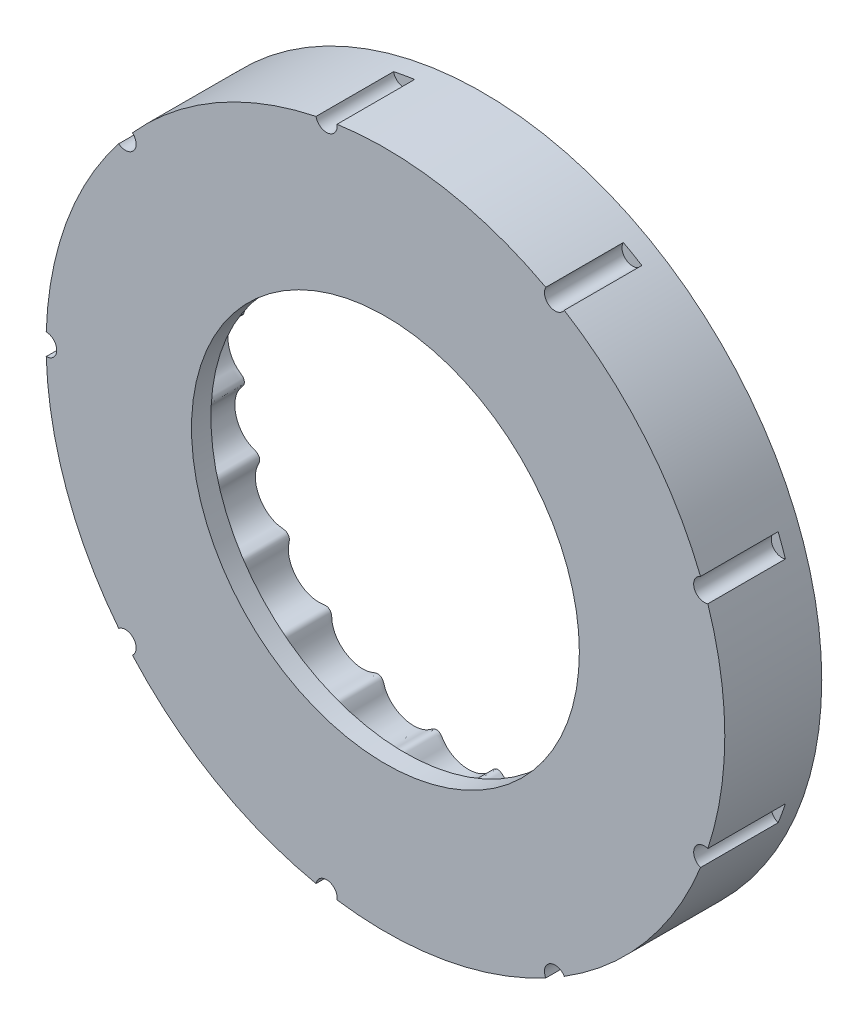
from build123d import *

# Parameters (mm, degrees)
ESQUISSE1_R             = 35
BOSS_EXTRU_1_DEPTH      = 8
ESQUISSE3_R             = 35
ESQUISSE3_R_2           = 20
BOSS_EXTRU_2_DEPTH      = 2
ESQUISSE4_R             = 1.1
ENL_V_MAT_EXTRU_2_DEPTH = 8


with BuildPart() as part:
    # Esquisse1 → Boss.-Extru.1 (new body)
    with BuildSketch(Plane.XY):
        Circle(ESQUISSE1_R)
        with BuildLine():
            add(Edge.make_bspline(
                [(24.75, 0), (24.75, -0.01190895), (24.750668659, -0.029768799), (24.75289752, -0.060006713), (24.758884934, -0.104774168), (24.767485304, -0.1467503), (24.785152354, -0.206071411), (24.818482478, -0.284185867), (24.880818803, -0.385919884), (24.984658612, -0.50047292), (25.114781066, -0.616600782), (25.255435339, -0.752464933), (25.419807145, -0.93333087), (25.594989864, -1.169106201), (25.768920192, -1.472936072), (25.920736133, -1.849650866), (26.023477253, -2.249860974), (26.074696747, -2.666946621), (26.073312156, -3.086313852), (26.020370658, -3.501501101), (25.917002683, -3.906273732), (25.764403676, -4.294347485), (25.566224565, -4.654785317), (25.325903213, -4.981499954), (25.081588671, -5.233067427), (24.851914535, -5.418631885), (24.667098284, -5.540217829), (24.539548747, -5.613941762), (24.410179088, -5.684594723), (24.273991814, -5.758046627), (24.120002912, -5.867762768), (23.989867, -6.050335584), (23.936355638, -6.275127193), (23.969192195, -6.495758333), (24.065351302, -6.684284012), (24.178449314, -6.851934675), (24.280144364, -7.019011908), (24.393570042, -7.235347013), (24.503436737, -7.50770452), (24.595094748, -7.84543671), (24.647032867, -8.248159789), (24.645694803, -8.661209862), (24.57595365, -9.185528563), (24.417645445, -9.696077248), (24.174741138, -10.176578568), (23.852030812, -10.610062282), (23.558837347, -10.90980476), (23.24095056, -11.157802847), (22.946586259, -11.329086722), (22.692113519, -11.440823192), (22.472657763, -11.513539342), (22.29388462, -11.561503733), (22.101259895, -11.606028638), (21.902055354, -11.681610724), (21.728453668, -11.828148656), (21.620885016, -12.038837081), (21.601595838, -12.263660858), (21.650481834, -12.469316746), (21.718254479, -12.659791435), (21.774584138, -12.84705718), (21.829677768, -13.084963879), (21.867201208, -13.376160202), (21.870688906, -13.725995236), (21.819474916, -14.128698884), (21.71419458, -14.527993453), (21.514773646, -15.017801417), (21.233133123, -15.4720736), (20.877140734, -15.876030958), (20.455657215, -16.214386724), (20.096354081, -16.430676116), (19.726170583, -16.590569736), (19.398076252, -16.68206281), (19.123633935, -16.725922166), (18.892914818, -16.74091163), (18.707848134, -16.742350192), (18.510091067, -16.737829569), (18.298399992, -16.764443666), (18.095471353, -16.866909122), (17.942147178, -17.047179332), (17.871387572, -17.261366287), (17.870202468, -17.472525416), (17.888313355, -17.673814374), (17.895669209, -17.869207586), (17.888886536, -18.113260777), (17.85168272, -18.404436203), (17.766823301, -18.743754438), (17.615819616, -19.120463832), (17.413434594, -19.48028858), (17.162321288, -19.816819375), (16.868500143, -20.122110223), (16.535786091, -20.390797243), (16.168397966, -20.617282366), (15.771042449, -20.795687849), (15.368766607, -20.914546396), (14.97017149, -20.975982916), (14.629556137, -20.981746846), (14.352921577, -20.954877105), (14.125857036, -20.911170138), (13.94640051, -20.866001244), (13.755772511, -20.812781493), (13.543469889, -20.788894817), (13.322238716, -20.84166807), (13.131407642, -20.981742865), (13.0130413, -21.173627181), (12.961818542, -21.378246364), (12.929064797, -21.57761534), (12.886990745, -21.768547341), (12.818791692, -22.002934942), (12.70930802, -22.275243379), (12.541628211, -22.582120244), (12.300626204, -22.908551746), (12.01422203, -23.205749325), (11.686582401, -23.4681837), (11.325453487, -23.689705246), (10.935854532, -23.866053147), (10.523258626, -23.992837457), (10.093696991, -24.06550579), (9.674368845, -24.079231972), (9.273085465, -24.038208914), (8.941983123, -23.957846351), (8.681067639, -23.861969077), (8.472360468, -23.762392874), (8.310008249, -23.673519219), (8.138322101, -23.574972467), (7.937182673, -23.501849574), (7.704899941, -23.502076627), (7.478095746, -23.600741865), (7.316947907, -23.77285878), (7.220831609, -23.97055906), (7.115634845, -24.203403783), (6.974300377, -24.460401189), (6.773045478, -24.737487424), (6.497851462, -25.02237666), (6.183428844, -25.270910892), (5.835740341, -25.479668636), (5.460328709, -25.645214949), (5.061542815, -25.765601822), (4.644666369, -25.83709061), (4.215744672, -25.855893135), (3.781608585, -25.818103671), (3.372294549, -25.725760832), (2.994169108, -25.584908149), (2.694109042, -25.423555897), (2.465647641, -25.264915254), (2.289085947, -25.115815571), (2.153739497, -24.989104422), (2.012318186, -24.851122457), (1.832423714, -24.733108156), (1.552983355, -24.66593755), (1.26214529, -24.754622086), (1.075414287, -24.957557798), (0.889090341, -25.194134228), (0.69672049, -25.401829912), (0.44758856, -25.61527269), (0.125683965, -25.821812182), (-0.224585626, -25.987068298), (-0.598975616, -26.109092558), (-0.990876156, -26.185347308), (-1.391941275, -26.2145582), (-1.796224618, -26.195837186), (-2.198144681, -26.128499562), (-2.591457519, -26.011923113), (-2.962803429, -25.848997421), (-3.306221845, -25.642423994), (-3.61537583, -25.39483403), (-3.850272783, -25.145621471), (-4.023133112, -24.908691884), (-4.156981332, -24.691054937), (-4.276293257, -24.506578487), (-4.456318725, -24.354528199), (-4.693068775, -24.282897531), (-4.923798246, -24.309710303), (-5.115035952, -24.406102337), (-5.273240645, -24.525178417), (-5.42301226, -24.633920894), (-5.617383402, -24.75923363), (-5.863981708, -24.887558689), (-6.182207181, -25.009385657), (-6.575059912, -25.101071531), (-6.9927825, -25.140689035), (-7.428136381, -25.123106217), (-7.851204623, -25.050059218), (-8.255644199, -24.926289526), (-8.635975215, -24.756290763), (-8.987390026, -24.544434268), (-9.305810055, -24.293211507), (-9.586131065, -24.006734367), (-9.822904508, -23.689158592), (-9.987239236, -23.388704672), (-10.094751199, -23.11580793), (-10.169610451, -22.871508954), (-10.24112571, -22.663502872), (-10.381175345, -22.473662137), (-10.594956363, -22.349311543), (-10.825624608, -22.322047042), (-11.033849204, -22.370890621), (-11.216381876, -22.447371753), (-11.388695767, -22.514940651), (-11.608352834, -22.58716666), (-11.87933894, -22.649041617), (-12.217942215, -22.68664221), (-12.621151131, -22.6763477), (-13.035301253, -22.609509201), (-13.452127793, -22.482943679), (-13.845292771, -22.304868342), (-14.20938889, -22.080540487), (-14.539531306, -21.814993299), (-14.831269767, -21.513076759), (-15.077661765, -21.181891436), (-15.275270226, -20.827454377), (-15.402577207, -20.501715906), (-15.476526159, -20.217667398), (-15.514326563, -19.976485954), (-15.531829272, -19.781749163), (-15.539202372, -19.579813227), (-15.565591069, -19.370421028), (-15.660806856, -19.1659885), (-15.83405536, -19.004717982), (-16.047591105, -18.926560558), (-16.261088064, -18.925182163), (-16.456798489, -18.954287053), (-16.640543184, -18.976331541), (-16.871307425, -18.990807395), (-17.149104778, -18.982241272), (-17.486194881, -18.933211709), (-17.873723074, -18.821638459), (-18.257615968, -18.652692803), (-18.629084532, -18.425342732), (-18.964764813, -18.15411038), (-19.260725449, -17.845401443), (-19.513475385, -17.50529118), (-19.719894943, -17.139574851), (-19.874988153, -16.756923442), (-19.976929286, -16.364037242), (-20.017953734, -16.016642642), (-20.017798024, -15.723070973), (-19.993447495, -15.480115157), (-19.96134753, -15.287225434), (-19.918054975, -15.089779832), (-19.89402871, -14.879875268), (-19.939362883, -14.658860507), (-20.070693635, -14.462043286), (-20.260249499, -14.336679591), (-20.467155514, -14.285214031), (-20.663881817, -14.2650629), (-20.847282484, -14.240161779), (-21.074211831, -14.195950386), (-21.340836688, -14.11751373), (-21.654611423, -13.985047804), (-22.001454707, -13.779432555), (-22.330360371, -13.519308084), (-22.705485211, -13.130240844), (-23.007369545, -12.684411231), (-23.229136266, -12.198075036), (-23.364819327, -11.686883469), (-23.418570267, -11.277399868), (-23.418213213, -10.871399708), (-23.370257339, -10.524800668), (-23.295965049, -10.240716159), (-23.211017087, -10.011726748), (-23.131365089, -9.833119484), (-23.040198426, -9.652618084), (-22.96715924, -9.454144986), (-22.960141523, -9.228680333), (-23.042373084, -9.007208297), (-23.198166311, -8.840665724), (-23.388940312, -8.741382585), (-23.57769294, -8.6722803), (-23.75308195, -8.599853942), (-23.966244513, -8.496298837), (-24.209343816, -8.347711506), (-24.48032477, -8.1355972), (-24.761295108, -7.846344695), (-25.008480075, -7.513349868), (-25.26655565, -7.04900195), (-25.442920247, -6.54763643), (-25.533949151, -6.025561479), (-25.536599067, -5.498854498), (-25.485486947, -5.088916426), (-25.382794666, -4.696000106), (-25.248906316, -4.372612425), (-25.105242941, -4.116427211), (-24.965170858, -3.916248887), (-24.843083512, -3.763442502), (-24.709834093, -3.611215538), (-24.591948067, -3.435387495), (-24.533798882, -3.220620895), (-24.560423715, -2.992589013), (-24.66665443, -2.797016304), (-24.822727104, -2.653701408), (-24.98966356, -2.53926073), (-25.146322188, -2.422077132), (-25.332496393, -2.263776399), (-25.502275925, -2.087254142), (-25.654526877, -1.895838833), (-25.79052351, -1.688263992), (-25.890012472, -1.511998867), (-25.978955887, -1.325507929), (-26.056614781, -1.131467198), (-26.121383307, -0.930707527), (-26.173241314, -0.729759288), (-26.207287779, -0.545661218), (-26.228372118, -0.39585777), (-26.240536879, -0.255725402), (-26.247025958, -0.16909655), (-26.249459241, -0.066739393), (-26.25, -0.022255367), (-26.25, 0)],
                knots=[0.07432085, 0.07432085, 0.07432085, 0.07432085, 0.07432085, 0.074838236, 0.075096929, 0.075355622, 0.075873009, 0.076390395, 0.077425167, 0.07845994, 0.080262761, 0.082065582, 0.083868403, 0.085671224, 0.089276866, 0.092882508, 0.096749545, 0.100616583, 0.104483621, 0.108350658, 0.112188336, 0.116026013, 0.11986369, 0.123701367, 0.12732655, 0.130951733, 0.132764324, 0.134576916, 0.135483211, 0.136389507, 0.138202099, 0.140295775, 0.142389451, 0.144458848, 0.146528245, 0.148330503, 0.150132762, 0.15193502, 0.153737278, 0.157341795, 0.160946311, 0.164812321, 0.16867833, 0.17254434, 0.180415799, 0.184421248, 0.188426697, 0.192432147, 0.195844027, 0.199255907, 0.200961848, 0.202667788, 0.204373728, 0.206079668, 0.208268892, 0.210458115, 0.21252702, 0.214595925, 0.216397713, 0.218199501, 0.220001289, 0.221803077, 0.225406654, 0.22901023, 0.232875219, 0.236740209, 0.240605199, 0.248476586, 0.252482983, 0.25648938, 0.260495777, 0.263907756, 0.267319735, 0.269025725, 0.270731714, 0.272437704, 0.274143693, 0.276335152, 0.278526612, 0.280594702, 0.282662792, 0.284464203, 0.286265613, 0.288067024, 0.289868435, 0.293471257, 0.297074079, 0.300938067, 0.304802055, 0.308666044, 0.312530032, 0.316537343, 0.320544653, 0.324551964, 0.328559274, 0.331971493, 0.335383713, 0.337089822, 0.338795932, 0.340502041, 0.342208151, 0.3444015, 0.346594848, 0.348661829, 0.35072881, 0.352529935, 0.354331061, 0.356132186, 0.357933311, 0.361535562, 0.365137813, 0.369000829, 0.372863844, 0.37672686, 0.380589876, 0.384598055, 0.388606234, 0.392614413, 0.396622592, 0.400035189, 0.403447785, 0.405154083, 0.406860381, 0.408566679, 0.410272977, 0.412467856, 0.414662735, 0.416905332, 0.41914793, 0.420947533, 0.422747136, 0.426346341, 0.429945547, 0.433544752, 0.437320979, 0.441097206, 0.444873433, 0.44864966, 0.452658654, 0.456667648, 0.460676642, 0.464685636, 0.468098738, 0.471511839, 0.473218389, 0.47492494, 0.476631491, 0.478338041, 0.480534086, 0.48273013, 0.487019518, 0.488748834, 0.49047815, 0.493936782, 0.497395414, 0.500854047, 0.504530334, 0.508206621, 0.511882908, 0.515559195, 0.519334982, 0.52311077, 0.526886557, 0.530662345, 0.534261527, 0.537860709, 0.541459892, 0.543259483, 0.545059074, 0.547300663, 0.549542252, 0.55173776, 0.553933267, 0.555639684, 0.5573461, 0.559052517, 0.560758933, 0.564171767, 0.5675846, 0.571593194, 0.575601788, 0.579610382, 0.583618976, 0.587395654, 0.591172332, 0.594949011, 0.598725689, 0.602324954, 0.605924219, 0.609523484, 0.611323117, 0.613122749, 0.615366313, 0.617609877, 0.619804036, 0.621998195, 0.623704391, 0.625410586, 0.627116782, 0.628822977, 0.632235368, 0.635647759, 0.63965551, 0.643663261, 0.647671012, 0.651678763, 0.655542261, 0.659405759, 0.663269257, 0.667132755, 0.670735268, 0.674337782, 0.676139039, 0.677940295, 0.679741552, 0.681542809, 0.683610379, 0.685677949, 0.687870397, 0.690062845, 0.691768886, 0.693474927, 0.695180968, 0.696887009, 0.700299091, 0.703711172, 0.707718031, 0.71172489, 0.715731748, 0.719738607, 0.723603093, 0.727467579, 0.731332066, 0.735196552, 0.738799727, 0.742402903, 0.744204491, 0.746006079, 0.747807667, 0.749609255, 0.751677791, 0.753746327, 0.755936711, 0.758127095, 0.75983305, 0.761539006, 0.763244962, 0.764950918, 0.76836283, 0.771774741, 0.775780668, 0.779786595, 0.783792522, 0.791663947, 0.795529445, 0.799394943, 0.803260441, 0.806864464, 0.810468487, 0.812270499, 0.81407251, 0.815874522, 0.817676533, 0.819745726, 0.821814919, 0.823998833, 0.826182748, 0.827931402, 0.829680057, 0.831428712, 0.833177366, 0.836674676, 0.840171985, 0.844093542, 0.8480151, 0.851936657, 0.859724738, 0.863591261, 0.867457784, 0.871324307, 0.874929364, 0.87853442, 0.880336948, 0.882139476, 0.883942004, 0.885744532, 0.887814048, 0.889883563, 0.891953048, 0.894022532, 0.895825669, 0.897628805, 0.899431941, 0.901235078, 0.90484135, 0.906644487, 0.908447623, 0.910381399, 0.912315175, 0.914248951, 0.916182727, 0.918116503, 0.920050278, 0.921017166, 0.921984054, 0.922950942, 0.92391783, 0.92391783, 0.92391783, 0.92391783, 0.92391783], degree=4))
            add(Edge.make_bspline(
                [(24.75, 0), (24.75, 0.01190895), (24.750668659, 0.029768799), (24.75289752, 0.060006713), (24.758884934, 0.104774168), (24.767485304, 0.1467503), (24.785152354, 0.206071411), (24.818482478, 0.284185867), (24.880818803, 0.385919884), (24.984658612, 0.50047292), (25.114781066, 0.616600782), (25.255435339, 0.752464933), (25.419807145, 0.93333087), (25.594989864, 1.169106201), (25.768920192, 1.472936072), (25.920736133, 1.849650866), (26.023477253, 2.249860974), (26.074696747, 2.666946621), (26.073312156, 3.086313852), (26.020370658, 3.501501101), (25.917002683, 3.906273732), (25.764403676, 4.294347485), (25.566224565, 4.654785317), (25.325903213, 4.981499954), (25.081588671, 5.233067427), (24.851914535, 5.418631885), (24.667098284, 5.540217829), (24.539548747, 5.613941762), (24.410179088, 5.684594723), (24.273991814, 5.758046627), (24.120002912, 5.867762768), (23.989867, 6.050335584), (23.936355638, 6.275127193), (23.969192195, 6.495758333), (24.065351302, 6.684284012), (24.178449314, 6.851934675), (24.280144364, 7.019011908), (24.393570042, 7.235347013), (24.503436737, 7.50770452), (24.595094748, 7.84543671), (24.647032867, 8.248159789), (24.645694803, 8.661209862), (24.57595365, 9.185528563), (24.417645445, 9.696077248), (24.174741138, 10.176578568), (23.852030812, 10.610062282), (23.558837347, 10.90980476), (23.24095056, 11.157802847), (22.946586259, 11.329086722), (22.692113519, 11.440823192), (22.472657763, 11.513539342), (22.29388462, 11.561503733), (22.101259895, 11.606028638), (21.902055354, 11.681610724), (21.728453668, 11.828148656), (21.620885016, 12.038837081), (21.601595838, 12.263660858), (21.650481834, 12.469316746), (21.718254479, 12.659791435), (21.774584138, 12.84705718), (21.829677768, 13.084963879), (21.867201208, 13.376160202), (21.870688906, 13.725995236), (21.819474916, 14.128698884), (21.71419458, 14.527993453), (21.514773646, 15.017801417), (21.233133123, 15.4720736), (20.877140734, 15.876030958), (20.455657215, 16.214386724), (20.096354081, 16.430676116), (19.726170583, 16.590569736), (19.398076252, 16.68206281), (19.123633935, 16.725922166), (18.892914818, 16.74091163), (18.707848134, 16.742350192), (18.510091067, 16.737829569), (18.298399992, 16.764443666), (18.095471353, 16.866909122), (17.942147178, 17.047179332), (17.871387572, 17.261366287), (17.870202468, 17.472525416), (17.888313355, 17.673814374), (17.895669209, 17.869207586), (17.888886536, 18.113260777), (17.85168272, 18.404436203), (17.766823301, 18.743754438), (17.615819616, 19.120463832), (17.413434594, 19.48028858), (17.162321288, 19.816819375), (16.868500143, 20.122110223), (16.535786091, 20.390797243), (16.168397966, 20.617282366), (15.771042449, 20.795687849), (15.368766607, 20.914546396), (14.97017149, 20.975982916), (14.629556137, 20.981746846), (14.352921577, 20.954877105), (14.125857036, 20.911170138), (13.94640051, 20.866001244), (13.755772511, 20.812781493), (13.543469889, 20.788894817), (13.322238716, 20.84166807), (13.131407642, 20.981742865), (13.0130413, 21.173627181), (12.961818542, 21.378246364), (12.929064797, 21.57761534), (12.886990745, 21.768547341), (12.818791692, 22.002934942), (12.70930802, 22.275243379), (12.541628211, 22.582120244), (12.300626204, 22.908551746), (12.01422203, 23.205749325), (11.686582401, 23.4681837), (11.325453487, 23.689705246), (10.935854532, 23.866053147), (10.523258626, 23.992837457), (10.093696991, 24.06550579), (9.674368845, 24.079231972), (9.273085465, 24.038208914), (8.941983123, 23.957846351), (8.681067639, 23.861969077), (8.472360468, 23.762392874), (8.310008249, 23.673519219), (8.138322101, 23.574972467), (7.937182673, 23.501849574), (7.704899941, 23.502076627), (7.478095746, 23.600741865), (7.316947907, 23.772858779), (7.220831609, 23.97055906), (7.115634845, 24.203403783), (6.974300377, 24.460401189), (6.773045477, 24.737487424), (6.497851462, 25.02237666), (6.183428844, 25.270910892), (5.835740341, 25.479668636), (5.460328709, 25.645214949), (5.061542815, 25.765601822), (4.644666369, 25.83709061), (4.215744672, 25.855893135), (3.781608585, 25.818103671), (3.372294549, 25.725760832), (2.994169108, 25.584908149), (2.694109042, 25.423555897), (2.465647641, 25.264915254), (2.289085947, 25.115815571), (2.153739497, 24.989104422), (2.012318186, 24.851122457), (1.832423714, 24.733108156), (1.552983354, 24.66593755), (1.26214529, 24.754622086), (1.075414287, 24.957557798), (0.889090341, 25.194134228), (0.69672049, 25.401829912), (0.44758856, 25.61527269), (0.125683965, 25.821812182), (-0.224585626, 25.987068298), (-0.598975616, 26.109092558), (-0.990876156, 26.185347308), (-1.391941275, 26.2145582), (-1.796224618, 26.195837186), (-2.198144681, 26.128499562), (-2.591457519, 26.011923113), (-2.962803429, 25.848997421), (-3.306221845, 25.642423994), (-3.61537583, 25.39483403), (-3.850272783, 25.145621471), (-4.023133112, 24.908691884), (-4.156981332, 24.691054937), (-4.276293257, 24.506578487), (-4.456318725, 24.354528199), (-4.693068775, 24.282897531), (-4.923798246, 24.309710303), (-5.115035952, 24.406102337), (-5.273240646, 24.525178417), (-5.42301226, 24.633920894), (-5.617383402, 24.75923363), (-5.863981708, 24.887558689), (-6.182207181, 25.009385657), (-6.575059912, 25.101071531), (-6.9927825, 25.140689035), (-7.428136381, 25.123106217), (-7.851204623, 25.050059218), (-8.255644199, 24.926289526), (-8.635975215, 24.756290763), (-8.987390026, 24.544434268), (-9.305810055, 24.293211507), (-9.586131065, 24.006734367), (-9.822904508, 23.689158592), (-9.987239236, 23.388704672), (-10.094751199, 23.11580793), (-10.169610451, 22.871508954), (-10.24112571, 22.663502872), (-10.381175345, 22.473662137), (-10.594956363, 22.349311543), (-10.825624608, 22.322047042), (-11.033849204, 22.370890621), (-11.216381876, 22.447371753), (-11.388695767, 22.514940651), (-11.608352834, 22.58716666), (-11.87933894, 22.649041617), (-12.217942215, 22.68664221), (-12.621151131, 22.676347699), (-13.035301253, 22.609509201), (-13.452127793, 22.482943679), (-13.845292771, 22.304868342), (-14.20938889, 22.080540487), (-14.539531306, 21.814993299), (-14.831269767, 21.513076759), (-15.077661765, 21.181891436), (-15.275270226, 20.827454377), (-15.402577207, 20.501715906), (-15.476526159, 20.217667398), (-15.514326563, 19.976485954), (-15.531829272, 19.781749163), (-15.539202372, 19.579813227), (-15.565591069, 19.370421028), (-15.660806856, 19.1659885), (-15.83405536, 19.004717982), (-16.047591105, 18.926560558), (-16.261088064, 18.925182163), (-16.456798489, 18.954287053), (-16.640543184, 18.976331541), (-16.871307425, 18.990807395), (-17.149104778, 18.982241272), (-17.486194881, 18.933211709), (-17.873723074, 18.821638459), (-18.257615968, 18.652692802), (-18.629084532, 18.425342732), (-18.964764813, 18.15411038), (-19.260725449, 17.845401443), (-19.513475385, 17.50529118), (-19.719894943, 17.139574851), (-19.874988153, 16.756923442), (-19.976929286, 16.364037242), (-20.017953734, 16.016642642), (-20.017798024, 15.723070973), (-19.993447495, 15.480115157), (-19.96134753, 15.287225434), (-19.918054975, 15.089779832), (-19.89402871, 14.879875268), (-19.939362883, 14.658860507), (-20.070693635, 14.462043286), (-20.260249499, 14.336679591), (-20.467155514, 14.285214031), (-20.663881817, 14.2650629), (-20.847282484, 14.240161779), (-21.074211831, 14.195950386), (-21.340836688, 14.11751373), (-21.654611423, 13.985047804), (-22.001454707, 13.779432555), (-22.330360371, 13.519308084), (-22.705485211, 13.130240844), (-23.007369545, 12.684411231), (-23.229136266, 12.198075036), (-23.364819327, 11.686883469), (-23.418570267, 11.277399868), (-23.418213213, 10.871399708), (-23.370257339, 10.524800667), (-23.295965049, 10.240716159), (-23.211017087, 10.011726748), (-23.131365089, 9.833119484), (-23.040198426, 9.652618084), (-22.96715924, 9.454144986), (-22.960141523, 9.228680333), (-23.042373084, 9.007208297), (-23.198166311, 8.840665724), (-23.388940312, 8.741382585), (-23.57769294, 8.6722803), (-23.75308195, 8.599853942), (-23.966244513, 8.496298837), (-24.209343816, 8.347711506), (-24.48032477, 8.1355972), (-24.761295108, 7.846344695), (-25.008480075, 7.513349868), (-25.26655565, 7.04900195), (-25.442920247, 6.54763643), (-25.533949151, 6.025561479), (-25.536599067, 5.498854498), (-25.485486947, 5.088916426), (-25.382794666, 4.696000106), (-25.248906316, 4.372612425), (-25.105242941, 4.116427211), (-24.965170858, 3.916248887), (-24.843083512, 3.763442502), (-24.709834093, 3.611215538), (-24.591948067, 3.435387495), (-24.533798882, 3.220620895), (-24.560423715, 2.992589013), (-24.66665443, 2.797016303), (-24.822727104, 2.653701408), (-24.98966356, 2.53926073), (-25.146322188, 2.422077132), (-25.332496393, 2.263776399), (-25.502275925, 2.087254142), (-25.654526877, 1.895838833), (-25.79052351, 1.688263992), (-25.890012472, 1.511998867), (-25.978955887, 1.325507929), (-26.056614781, 1.131467198), (-26.121383307, 0.930707527), (-26.173241314, 0.729759288), (-26.207287779, 0.545661218), (-26.228372118, 0.39585777), (-26.240536879, 0.255725402), (-26.247025958, 0.16909655), (-26.249459241, 0.066739393), (-26.25, 0.022255367), (-26.25, 0)],
                knots=[0.07432085, 0.07432085, 0.07432085, 0.07432085, 0.07432085, 0.074838236, 0.075096929, 0.075355622, 0.075873009, 0.076390395, 0.077425167, 0.07845994, 0.080262761, 0.082065582, 0.083868403, 0.085671224, 0.089276866, 0.092882508, 0.096749545, 0.100616583, 0.104483621, 0.108350658, 0.112188336, 0.116026013, 0.11986369, 0.123701367, 0.12732655, 0.130951733, 0.132764324, 0.134576916, 0.135483211, 0.136389507, 0.138202099, 0.140295775, 0.142389451, 0.144458848, 0.146528245, 0.148330503, 0.150132762, 0.15193502, 0.153737278, 0.157341795, 0.160946311, 0.164812321, 0.16867833, 0.17254434, 0.180415799, 0.184421248, 0.188426697, 0.192432147, 0.195844027, 0.199255907, 0.200961848, 0.202667788, 0.204373728, 0.206079668, 0.208268892, 0.210458115, 0.21252702, 0.214595925, 0.216397713, 0.218199501, 0.220001289, 0.221803077, 0.225406654, 0.22901023, 0.232875219, 0.236740209, 0.240605199, 0.248476586, 0.252482983, 0.25648938, 0.260495777, 0.263907756, 0.267319735, 0.269025725, 0.270731714, 0.272437704, 0.274143693, 0.276335152, 0.278526612, 0.280594702, 0.282662792, 0.284464203, 0.286265613, 0.288067024, 0.289868435, 0.293471257, 0.297074079, 0.300938067, 0.304802055, 0.308666044, 0.312530032, 0.316537343, 0.320544653, 0.324551964, 0.328559274, 0.331971493, 0.335383713, 0.337089822, 0.338795932, 0.340502041, 0.342208151, 0.3444015, 0.346594848, 0.348661829, 0.35072881, 0.352529935, 0.354331061, 0.356132186, 0.357933311, 0.361535562, 0.365137813, 0.369000829, 0.372863844, 0.37672686, 0.380589876, 0.384598055, 0.388606234, 0.392614413, 0.396622592, 0.400035189, 0.403447785, 0.405154083, 0.406860381, 0.408566679, 0.410272977, 0.412467856, 0.414662735, 0.416905332, 0.41914793, 0.420947533, 0.422747136, 0.426346341, 0.429945547, 0.433544752, 0.437320979, 0.441097206, 0.444873433, 0.44864966, 0.452658654, 0.456667648, 0.460676642, 0.464685636, 0.468098738, 0.471511839, 0.473218389, 0.47492494, 0.476631491, 0.478338041, 0.480534086, 0.48273013, 0.487019518, 0.488748834, 0.49047815, 0.493936782, 0.497395414, 0.500854047, 0.504530334, 0.508206621, 0.511882908, 0.515559195, 0.519334982, 0.52311077, 0.526886557, 0.530662345, 0.534261527, 0.537860709, 0.541459892, 0.543259483, 0.545059074, 0.547300663, 0.549542252, 0.55173776, 0.553933267, 0.555639684, 0.5573461, 0.559052517, 0.560758933, 0.564171767, 0.5675846, 0.571593194, 0.575601788, 0.579610382, 0.583618976, 0.587395654, 0.591172332, 0.594949011, 0.598725689, 0.602324954, 0.605924219, 0.609523484, 0.611323117, 0.613122749, 0.615366313, 0.617609877, 0.619804036, 0.621998195, 0.623704391, 0.625410586, 0.627116782, 0.628822977, 0.632235368, 0.635647759, 0.63965551, 0.643663261, 0.647671012, 0.651678763, 0.655542261, 0.659405759, 0.663269257, 0.667132755, 0.670735268, 0.674337782, 0.676139039, 0.677940295, 0.679741552, 0.681542809, 0.683610379, 0.685677949, 0.687870397, 0.690062845, 0.691768886, 0.693474927, 0.695180968, 0.696887009, 0.700299091, 0.703711172, 0.707718031, 0.71172489, 0.715731748, 0.719738607, 0.723603093, 0.727467579, 0.731332066, 0.735196552, 0.738799727, 0.742402903, 0.744204491, 0.746006079, 0.747807667, 0.749609255, 0.751677791, 0.753746327, 0.755936711, 0.758127095, 0.75983305, 0.761539006, 0.763244962, 0.764950918, 0.76836283, 0.771774741, 0.775780668, 0.779786595, 0.783792522, 0.791663947, 0.795529445, 0.799394943, 0.803260441, 0.806864464, 0.810468487, 0.812270499, 0.81407251, 0.815874522, 0.817676533, 0.819745726, 0.821814919, 0.823998833, 0.826182748, 0.827931402, 0.829680057, 0.831428712, 0.833177366, 0.836674676, 0.840171985, 0.844093542, 0.8480151, 0.851936657, 0.859724738, 0.863591261, 0.867457784, 0.871324307, 0.874929364, 0.87853442, 0.880336948, 0.882139476, 0.883942004, 0.885744532, 0.887814048, 0.889883563, 0.891953048, 0.894022532, 0.895825669, 0.897628805, 0.899431941, 0.901235078, 0.90484135, 0.906644487, 0.908447623, 0.910381399, 0.912315175, 0.914248951, 0.916182727, 0.918116503, 0.920050278, 0.921017166, 0.921984054, 0.922950942, 0.92391783, 0.92391783, 0.92391783, 0.92391783, 0.92391783], degree=4))
        make_face(mode=Mode.SUBTRACT)
    extrude(amount=BOSS_EXTRU_1_DEPTH)

    # Esquisse3 → Boss.-Extru.2 (add)
    with BuildSketch(Plane.XY.offset(8)):
        Circle(ESQUISSE3_R)
        Circle(ESQUISSE3_R_2, mode=Mode.SUBTRACT)
    extrude(amount=BOSS_EXTRU_2_DEPTH)

    # Esquisse4 → Enlèv. mat.-Extru.2 (cut)
    with BuildSketch(Plane.XY.offset(10)):
        with Locations((-35, 0)):
            Circle(ESQUISSE4_R)
        with Locations((-26.811555509, 22.497566339)):
            Circle(ESQUISSE4_R)
        with Locations((-6.077686218, 34.468271355)):
            Circle(ESQUISSE4_R)
        with Locations((17.5, 30.310889132)):
            Circle(ESQUISSE4_R)
        with Locations((32.889241728, 11.970705016)):
            Circle(ESQUISSE4_R)
        with Locations((32.889241728, -11.970705016)):
            Circle(ESQUISSE4_R)
        with Locations((17.5, -30.310889132)):
            Circle(ESQUISSE4_R)
        with Locations((-6.077686218, -34.468271355)):
            Circle(ESQUISSE4_R)
        with Locations((-26.811555509, -22.497566339)):
            Circle(ESQUISSE4_R)
    extrude(amount=-ENL_V_MAT_EXTRU_2_DEPTH, mode=Mode.SUBTRACT)


solid = part.part
